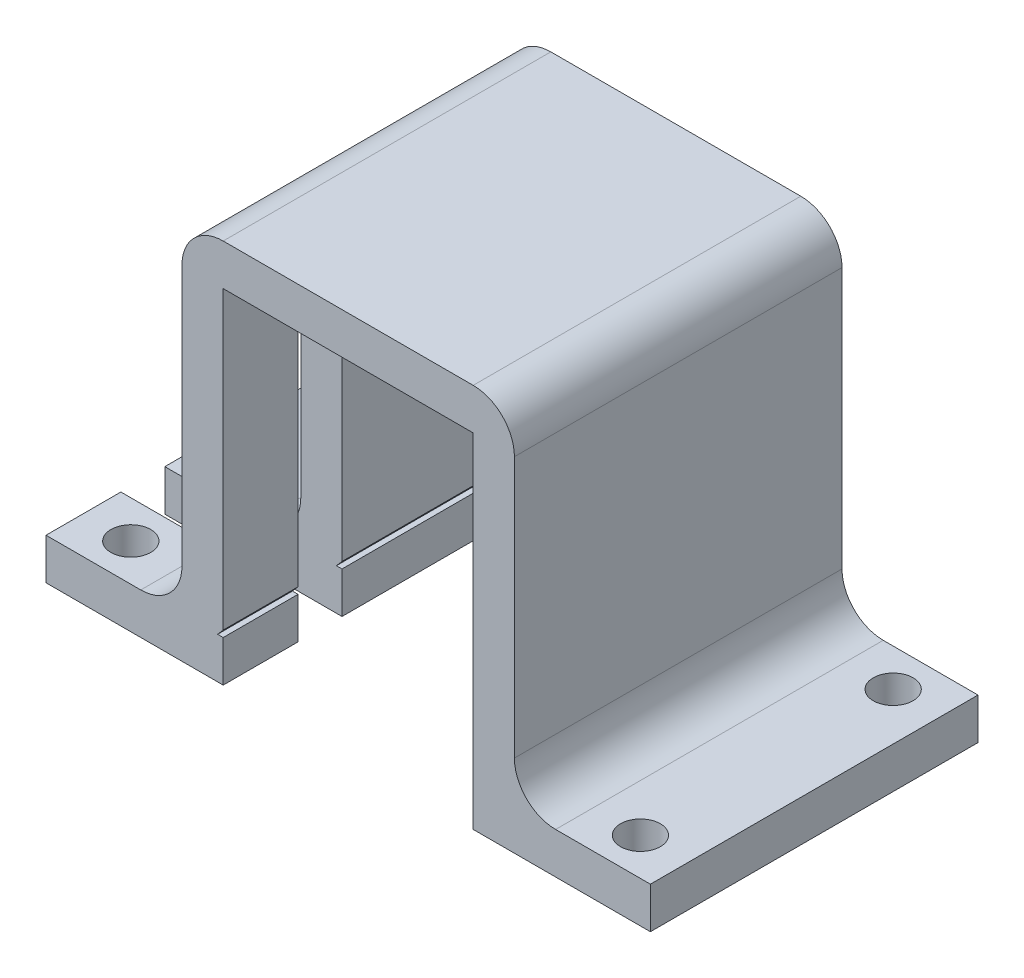
from build123d import *

# Parameters (mm, degrees)
BOSS_EXTRUDE1_DEPTH     = 23.85
CUT_EXTRUDE2_DEPTH      = 12
CUT_EXTRUDE2_DEPTH_BACK = 10
SKETCH2_W               = 3.2
SKETCH2_H               = 20
SKETCH4_R               = 1.45
CUT_EXTRUDE3_DEPTH      = 10


with BuildPart() as part:
    # Sketch1 → Boss-Extrude1 (new body)
    with BuildSketch(Plane.XY):
        with BuildLine():
            Line((-9.1, -10.52892562), (-9.1, 11))
            Line((-9.1, 11), (9.1, 11))
            Line((9.1, 11), (9.1, -11))
            Line((9.1, -11), (9.1, -14))
            Line((9.1, -14), (12.1, -14))
            Line((12.1, -14), (22, -14))
            Line((22, -14), (22, -11))
            Line((22, -11), (15.1, -11))
            ThreePointArc((15.1, -11), (12.978679656, -10.121320344), (12.1, -8))
            Line((12.1, -8), (12.1, 11))
            ThreePointArc((12.1, 11), (11.221320344, 13.121320344), (9.1, 14))
            Line((9.1, 14), (-9.1, 14))
            ThreePointArc((-9.1, 14), (-11.221320344, 13.121320344), (-12.1, 11))
            Line((-12.1, 11), (-12.1, -8))
            ThreePointArc((-12.1, -8), (-12.978679656, -10.121320344), (-15.1, -11))
            Line((-15.1, -11), (-22, -11))
            Line((-22, -11), (-22, -14))
            Line((-22, -14), (-12.1, -14))
            Line((-12.1, -14), (-9.1, -14))
            Line((-9.1, -14), (-9.1, -11))
            Line((-9.1, -11), (-9.507142857, -11))
            Line((-9.507142857, -11), (-9.1, -10.52892562))
        make_face()
    extrude(amount=BOSS_EXTRUDE1_DEPTH)

    # Sketch2 → Cut-Extrude2 (cut, two sides: drawn at the far end of the back side and taken through both)
    with BuildSketch(Plane.ZY.offset(12.1).offset(-CUT_EXTRUDE2_DEPTH_BACK)):
        with Locations((16.8, -4)):
            Rectangle(SKETCH2_W, SKETCH2_H)
    extrude(amount=CUT_EXTRUDE2_DEPTH + CUT_EXTRUDE2_DEPTH_BACK, mode=Mode.SUBTRACT)

    # Sketch4 → Cut-Extrude3 (cut)
    with BuildSketch(Plane(origin=(0, -11, 0), x_dir=(1, 0, 0), z_dir=(0, 1, 0))):
        with Locations(Location((-18.55, -21.125, 0), (0, 0, 180))):
            Circle(SKETCH4_R)
        with Locations(Location((-18.55, -2.725, 0), (0, 0, 180))):
            Circle(SKETCH4_R)
        with Locations(Location((18.55, -21.125, 0), (0, 0, 270))):
            Circle(SKETCH4_R)
        with Locations(Location((18.55, -2.725, 0), (0, 0, 180))):
            Circle(SKETCH4_R)
    extrude(amount=-CUT_EXTRUDE3_DEPTH, mode=Mode.SUBTRACT)


solid = part.part
